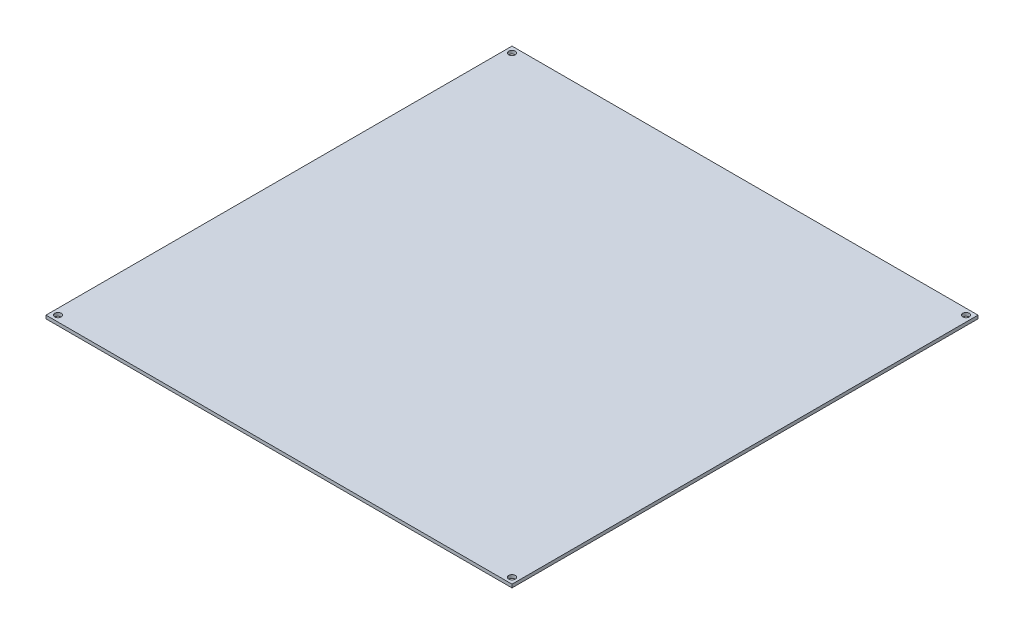
from build123d import *

# Parameters (mm, degrees)
CROQUIS1_W              = 214
CROQUIS1_H              = 214
CROQUIS1_R              = 1.5
SALIENTE_EXTRUIR2_DEPTH = 1.5


with BuildPart() as part:
    # Croquis1 → Saliente-Extruir2 (new body)
    with BuildSketch(Plane(origin=(0, 0, 0), x_dir=(1, 0, 0), z_dir=(0, 1, 0))):
        with Locations((-18.043137255, -45.317647059)):
            Rectangle(CROQUIS1_W, CROQUIS1_H)
        with Locations(Location((-122.293137255, 58.932352941, 0), (0, 0, 270))):
            Circle(CROQUIS1_R, mode=Mode.SUBTRACT)
        with Locations(Location((86.206862745, 58.932352941, 0), (0, 0, 270))):
            Circle(CROQUIS1_R, mode=Mode.SUBTRACT)
        with Locations(Location((-122.293137255, -149.567647059, 0), (0, 0, 270))):
            Circle(CROQUIS1_R, mode=Mode.SUBTRACT)
        with Locations(Location((86.206862745, -149.567647059, 0), (0, 0, 270))):
            Circle(CROQUIS1_R, mode=Mode.SUBTRACT)
    extrude(amount=SALIENTE_EXTRUIR2_DEPTH)


solid = part.part
